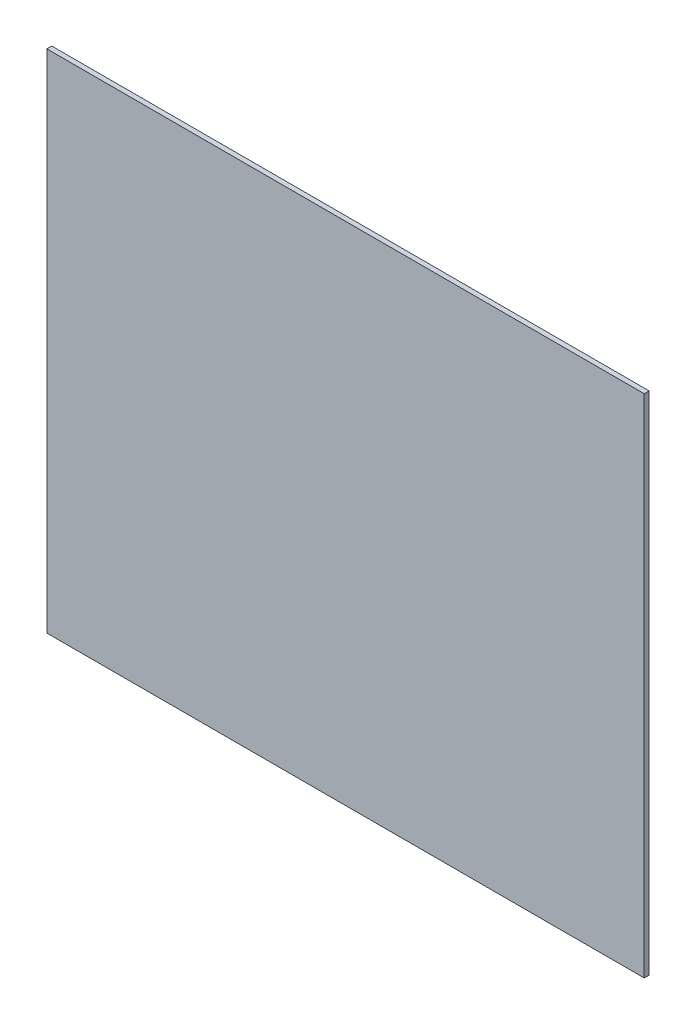
from build123d import *

# Parameters (mm, degrees)
SKETCH_1_W      = 366
SKETCH_1_H      = 310
EXTRUDE_1_DEPTH = 3


with BuildPart() as part:
    # 草图1 → 凸台-拉伸1 (new body)
    with BuildSketch(Plane.XY):
        with Locations((183, 155)):
            Rectangle(SKETCH_1_W, SKETCH_1_H)
    extrude(amount=EXTRUDE_1_DEPTH)


solid = part.part
